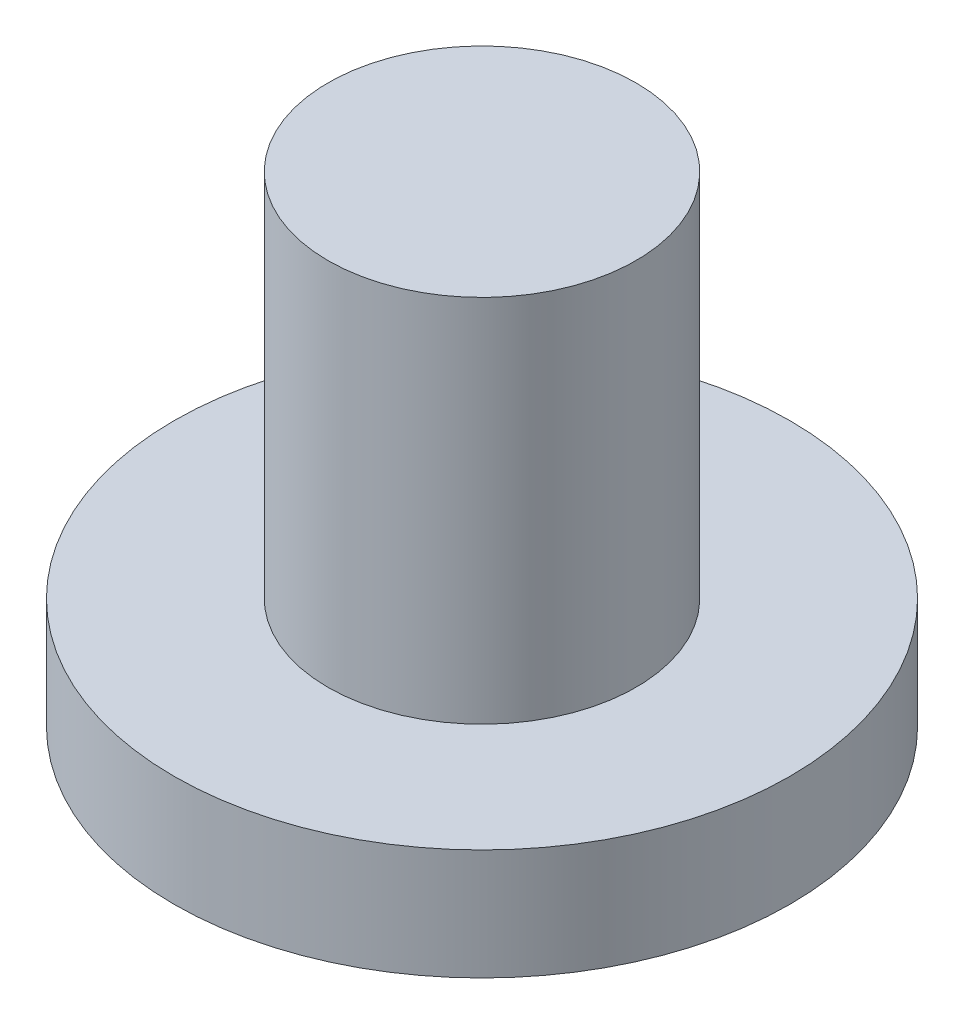
from build123d import *

# Parameters (mm, degrees)
SKETCH_1_R          = 2.5
EXTRUDE_1_DEPTH     = 0.9
SKETCH_2_R          = 1.25
EXTRUDE_2_DEPTH     = 3
CUT_EXTRUDE_1_DEPTH = 0.5


with BuildPart() as part:
    # 草图1 → 凸台-拉伸1 (new body)
    with BuildSketch(Plane(origin=(0, 0, 0), x_dir=(1, 0, 0), z_dir=(0, 1, 0))):
        with Locations(Location((0, 0, 0), (0, 0, 270))):
            Circle(SKETCH_1_R)
    extrude(amount=EXTRUDE_1_DEPTH)

    # 草图2 → 凸台-拉伸2 (add)
    with BuildSketch(Plane(origin=(0, 0.9, 0), x_dir=(1, 0, 0), z_dir=(0, 1, 0))):
        with Locations(Location((0, 0, 0), (0, 0, 270))):
            Circle(SKETCH_2_R)
    extrude(amount=EXTRUDE_2_DEPTH)

    # 草图3 → 切除-拉伸1 (cut)
    with BuildSketch(Plane.XZ):
        Polygon((0.433012702, 0.75), (-0.433012702, 0.75), (-0.866025404, 0), (-0.433012702, -0.75), (0.433012702, -0.75), (0.866025404, 0), align=None)
    extrude(amount=-CUT_EXTRUDE_1_DEPTH, mode=Mode.SUBTRACT)


solid = part.part
